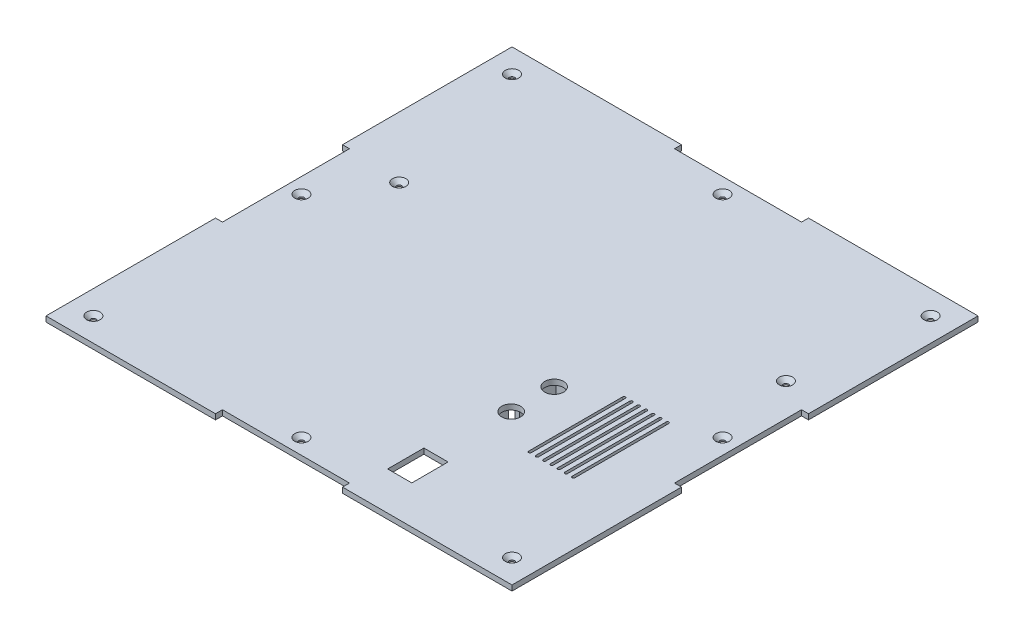
from build123d import *

# Parameters (mm, degrees)
BOSS_EXTRUDE1_DEPTH = 2
SKETCH2_R           = 1
CUT_EXTRUDE1_DEPTH  = 123.699327627
CHAMFER1_SIZE       = 1.5
CUT_EXTRUDE3_DEPTH  = 123.699327627
SKETCH3_W           = 9
SKETCH3_H           = 13.5
CUT_EXTRUDE2_DEPTH  = 123.699327627
SKETCH5_W           = 17
SKETCH5_H           = 34.5
SKETCH5_W_2         = 14
SKETCH5_H_2         = 31.5
BOSS_EXTRUDE2_DEPTH = 10
SKETCH7_R           = 3.5
CUT_EXTRUDE5_DEPTH  = 124.089906166
SKETCH6_W           = 1.5
SKETCH6_H           = 4
CUT_EXTRUDE4_DEPTH  = 10
SKETCH8_R           = 6
SKETCH8_R_2         = 5
BOSS_EXTRUDE3_DEPTH = 1


with BuildPart() as part:
    # Sketch1 → Boss-Extrude1 (new body)
    with BuildSketch(Plane(origin=(0, 0, 0), x_dir=(1, 0, 0), z_dir=(0, 1, 0))):
        Polygon((23.65, -86.75), (86.75, -86.75), (86.75, -23.65), (84.15, -23.65), (84.15, 23.65), (86.75, 23.65), (86.75, 86.75), (23.65, 86.75), (23.65, 84.15), (-23.65, 84.15), (-23.65, 86.75), (-86.75, 86.75), (-86.75, 23.65), (-84.15, 23.65), (-84.15, -23.65), (-86.75, -23.65), (-86.75, -86.75), (-23.65, -86.75), (-23.65, -84.15), (23.65, -84.15), align=None)
    extrude(amount=BOSS_EXTRUDE1_DEPTH)

    # Sketch2 → Cut-Extrude1 (cut, through all)
    with BuildSketch(Plane.XZ):
        with Locations(Location((-77.928932188, 77.928932188, 0), (0, 0, 270))):
            Circle(SKETCH2_R)
        with Locations(Location((0, 78.4, 0), (0, 0, 270))):
            Circle(SKETCH2_R)
        with Locations(Location((77.928932188, 77.928932188, 0), (0, 0, 270))):
            Circle(SKETCH2_R)
        with Locations(Location((-78.4, 0, 0), (0, 0, 270))):
            Circle(SKETCH2_R)
        with Locations(Location((78.4, 0, 0), (0, 0, 270))):
            Circle(SKETCH2_R)
        with Locations(Location((72, -30, 0), (0, 0, 270))):
            Circle(SKETCH2_R)
        with Locations(Location((-64, -22, 0), (0, 0, 270))):
            Circle(SKETCH2_R)
        with Locations(Location((-77.928932188, -77.928932188, 0), (0, 0, 270))):
            Circle(SKETCH2_R)
        with Locations(Location((0, -78.4, 0), (0, 0, 270))):
            Circle(SKETCH2_R)
        with Locations(Location((77.928932188, -77.928932188, 0), (0, 0, 270))):
            Circle(SKETCH2_R)
    extrude(amount=-CUT_EXTRUDE1_DEPTH, mode=Mode.SUBTRACT)

    # Chamfer1
    chamfer1_edges = [part.edges().sort_by_distance(p)[0] for p in [
        (-77.928932188, 2, 78.928932188),
        (0, 2, 79.4),
        (77.928932188, 2, 78.928932188),
        (-78.4, 2, 1),
        (78.4, 2, 1),
        (72, 2, -29),
        (-64, 2, -21),
        (-77.928932188, 2, -76.928932188),
        (0, 2, -77.4),
        (77.928932188, 2, -76.928932188),
    ]]
    chamfer(chamfer1_edges, length=CHAMFER1_SIZE)

    # Sketch4 → Cut-Extrude3 (cut, through all)
    with BuildSketch(Plane.XZ):
        with BuildLine():
            Line((47.7, 40.5), (47.7, 5.5))
            ThreePointArc((47.7, 5.5), (47.2, 5), (46.7, 5.5))
            Line((46.7, 5.5), (46.7, 40.5))
            ThreePointArc((46.7, 40.5), (47.2, 41), (47.7, 40.5))
        make_face()
        with BuildLine():
            Line((50.4, 40.5), (50.4, 5.5))
            ThreePointArc((50.4, 5.5), (49.9, 5), (49.4, 5.5))
            Line((49.4, 5.5), (49.4, 40.5))
            ThreePointArc((49.4, 40.5), (49.9, 41), (50.4, 40.5))
        make_face()
        with BuildLine():
            Line((53.1, 40.5), (53.1, 5.5))
            ThreePointArc((53.1, 5.5), (52.6, 5), (52.1, 5.5))
            Line((52.1, 5.5), (52.1, 40.5))
            ThreePointArc((52.1, 40.5), (52.6, 41), (53.1, 40.5))
        make_face()
        with BuildLine():
            Line((55.8, 40.5), (55.8, 5.5))
            ThreePointArc((55.8, 5.5), (55.3, 5), (54.8, 5.5))
            Line((54.8, 5.5), (54.8, 40.5))
            ThreePointArc((54.8, 40.5), (55.3, 41), (55.8, 40.5))
        make_face()
        with BuildLine():
            Line((58.5, 40.5), (58.5, 5.5))
            ThreePointArc((58.5, 5.5), (58, 5), (57.5, 5.5))
            Line((57.5, 5.5), (57.5, 40.5))
            ThreePointArc((57.5, 40.5), (58, 41), (58.5, 40.5))
        make_face()
        with BuildLine():
            Line((61.2, 40.5), (61.2, 5.5))
            ThreePointArc((61.2, 5.5), (60.7, 5), (60.2, 5.5))
            Line((60.2, 5.5), (60.2, 40.5))
            ThreePointArc((60.2, 40.5), (60.7, 41), (61.2, 40.5))
        make_face()
        with BuildLine():
            Line((63.9, 40.5), (63.9, 5.5))
            ThreePointArc((63.9, 5.5), (63.4, 5), (62.9, 5.5))
            Line((62.9, 5.5), (62.9, 40.5))
            ThreePointArc((62.9, 40.5), (63.4, 41), (63.9, 40.5))
        make_face()
    extrude(amount=-CUT_EXTRUDE3_DEPTH, mode=Mode.SUBTRACT)

    # Sketch3 → Cut-Extrude2 (cut, through all)
    with BuildSketch(Plane.XZ):
        with Locations((30.7, 65.75)):
            Rectangle(SKETCH3_W, SKETCH3_H)
    extrude(amount=-CUT_EXTRUDE2_DEPTH, mode=Mode.SUBTRACT)

    # Sketch5 → Boss-Extrude2 (add)
    with BuildSketch(Plane.XZ):
        with Locations((30.7, 23)):
            Rectangle(SKETCH5_W, SKETCH5_H)
        with Locations((30.7, 23)):
            Rectangle(SKETCH5_W_2, SKETCH5_H_2, mode=Mode.SUBTRACT)
    extrude(amount=BOSS_EXTRUDE2_DEPTH)

    # Sketch7 → Cut-Extrude5 (cut, through all)
    with BuildSketch(Plane.XZ):
        with Locations(Location((30.7, 15, 0), (0, 0, 270))):
            Circle(SKETCH7_R)
        with Locations(Location((30.7, 31, 0), (0, 0, 270))):
            Circle(SKETCH7_R)
    extrude(amount=-CUT_EXTRUDE5_DEPTH, mode=Mode.SUBTRACT)

    # Sketch6 → Cut-Extrude4 (cut)
    with BuildSketch(Plane.XZ.offset(10)):
        with Locations((22.95, 23)):
            Rectangle(SKETCH6_W, SKETCH6_H)
    extrude(amount=-CUT_EXTRUDE4_DEPTH, mode=Mode.SUBTRACT)

    # Sketch8 → Boss-Extrude3 (add)
    # profile 1 of 2: a face of its own
    with BuildSketch(Plane.XZ):
        with Locations(Location((30.7, 31, 0), (0, 0, 90))):
            Circle(SKETCH8_R)
        with Locations(Location((30.7, 31, 0), (0, 0, 270))):
            Circle(SKETCH8_R_2, mode=Mode.SUBTRACT)
    # profile 2 of 2: a face of its own
    with BuildSketch(Plane.XZ):
        with Locations(Location((30.7, 15, 0), (0, 0, 90))):
            Circle(SKETCH8_R)
        with Locations(Location((30.7, 15, 0), (0, 0, 270))):
            Circle(SKETCH8_R_2, mode=Mode.SUBTRACT)
    extrude(amount=BOSS_EXTRUDE3_DEPTH)


solid = part.part
